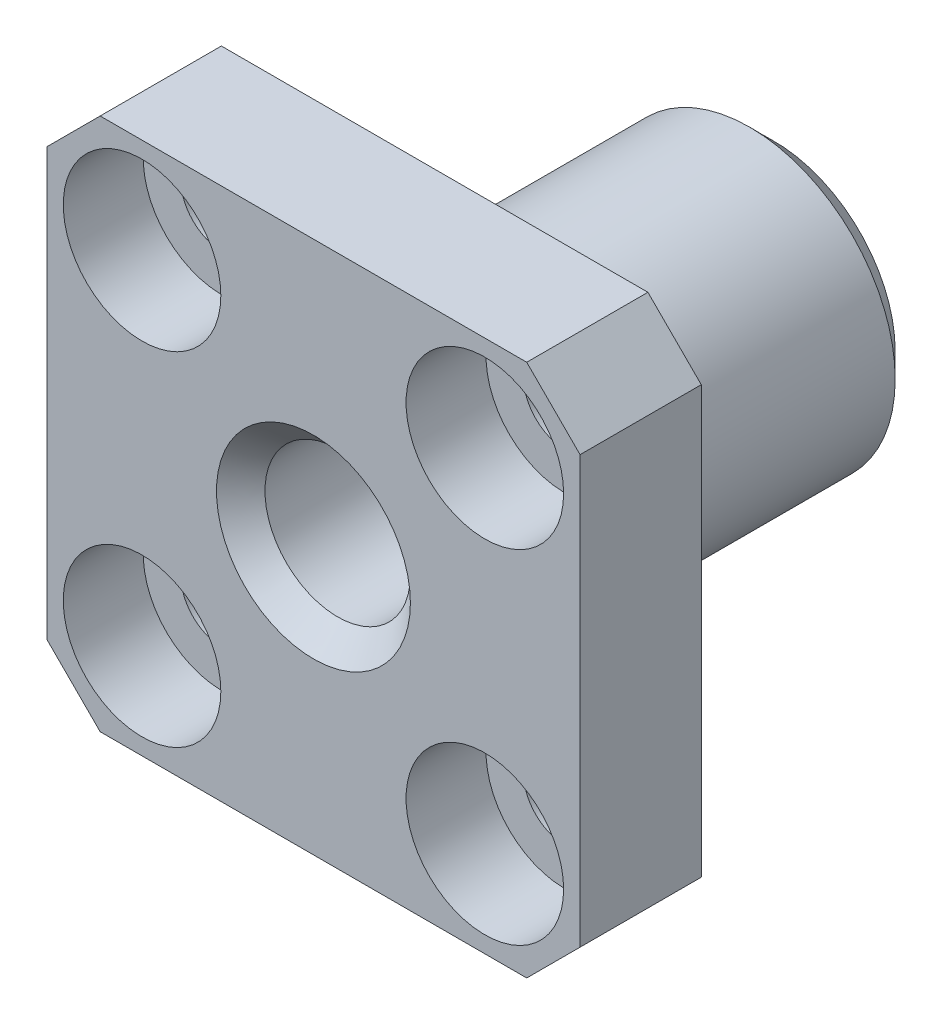
from build123d import *

# Parameters (mm, degrees)
SKETCH1_R                                           = 6
BOSS_EXTRUDE1_DEPTH                                 = 19
SKETCH2_W                                           = 22
SKETCH2_H                                           = 22
BOSS_EXTRUDE2_DEPTH                                 = 5
CUT_EXTRUDE1_DEPTH                                  = 25.556058316
CBORE_FOR_M3_HEX_SOCKET_HEAD_CAP_SCREW1_D           = 3.4
CBORE_FOR_M3_HEX_SOCKET_HEAD_CAP_SCREW1_DEPTH       = 22
CBORE_FOR_M3_HEX_SOCKET_HEAD_CAP_SCREW1_CBORE_D     = 6.5
CBORE_FOR_M3_HEX_SOCKET_HEAD_CAP_SCREW1_CBORE_DEPTH = 3.3
CBORE_FOR_M3_HEX_SOCKET_HEAD_CAP_SCREW1_TIP         = 1.021463052
SKETCH8_R                                           = 3
CUT_EXTRUDE2_DEPTH                                  = 25.556058316
CHAMFER1_SIZE                                       = 1


with BuildPart() as part:
    # Sketch1 → Boss-Extrude1 (new body)
    with BuildSketch(Plane.XY):
        Circle(SKETCH1_R)
    extrude(amount=BOSS_EXTRUDE1_DEPTH)

    # Sketch2 → Boss-Extrude2 (add)
    with BuildSketch(Plane.XY.offset(19)):
        Rectangle(SKETCH2_W, SKETCH2_H)
    extrude(amount=-BOSS_EXTRUDE2_DEPTH)

    # Sketch4 → Cut-Extrude1 (cut, through all)
    with BuildSketch(Plane.XY.offset(19)):
        Polygon((-11, 11), (-11, 8.798989873), (-8.798989873, 11), align=None)
        Polygon((8.798989873, 11), (11, 11), (11, 8.798989873), align=None)
        Polygon((11, -11), (11, -8.798989873), (8.798989873, -11), align=None)
        Polygon((-8.798989873, -11), (-11, -11), (-11, -8.798989873), align=None)
    extrude(amount=-CUT_EXTRUDE1_DEPTH, mode=Mode.SUBTRACT)

    # CBORE for M3 Hex Socket Head Cap Screw1
    with Locations(Plane.XY.offset(19)):
        with Locations((-7.071067812, 7.071067812), (7.071067812, 7.071067812), (7.071067812, -7.071067812), (-7.071067812, -7.071067812)):
            CounterBoreHole(CBORE_FOR_M3_HEX_SOCKET_HEAD_CAP_SCREW1_D / 2, CBORE_FOR_M3_HEX_SOCKET_HEAD_CAP_SCREW1_CBORE_D / 2, CBORE_FOR_M3_HEX_SOCKET_HEAD_CAP_SCREW1_CBORE_DEPTH, depth=CBORE_FOR_M3_HEX_SOCKET_HEAD_CAP_SCREW1_DEPTH)
            with Locations((0, 0, -(CBORE_FOR_M3_HEX_SOCKET_HEAD_CAP_SCREW1_DEPTH + CBORE_FOR_M3_HEX_SOCKET_HEAD_CAP_SCREW1_TIP / 2))):  # 118° drill point
                Cone(0, CBORE_FOR_M3_HEX_SOCKET_HEAD_CAP_SCREW1_D / 2, CBORE_FOR_M3_HEX_SOCKET_HEAD_CAP_SCREW1_TIP, mode=Mode.SUBTRACT)

    # Sketch8 → Cut-Extrude2 (cut, through all)
    with BuildSketch(Plane.XY.offset(19)):
        Circle(SKETCH8_R)
    extrude(amount=-CUT_EXTRUDE2_DEPTH, mode=Mode.SUBTRACT)

    # Chamfer1
    chamfer1_edges = [part.edges().sort_by_distance(p)[0] for p in [
        (-3, 0, 19),
        (-6, 0, 0),
    ]]
    chamfer(chamfer1_edges, length=CHAMFER1_SIZE)


solid = part.part
